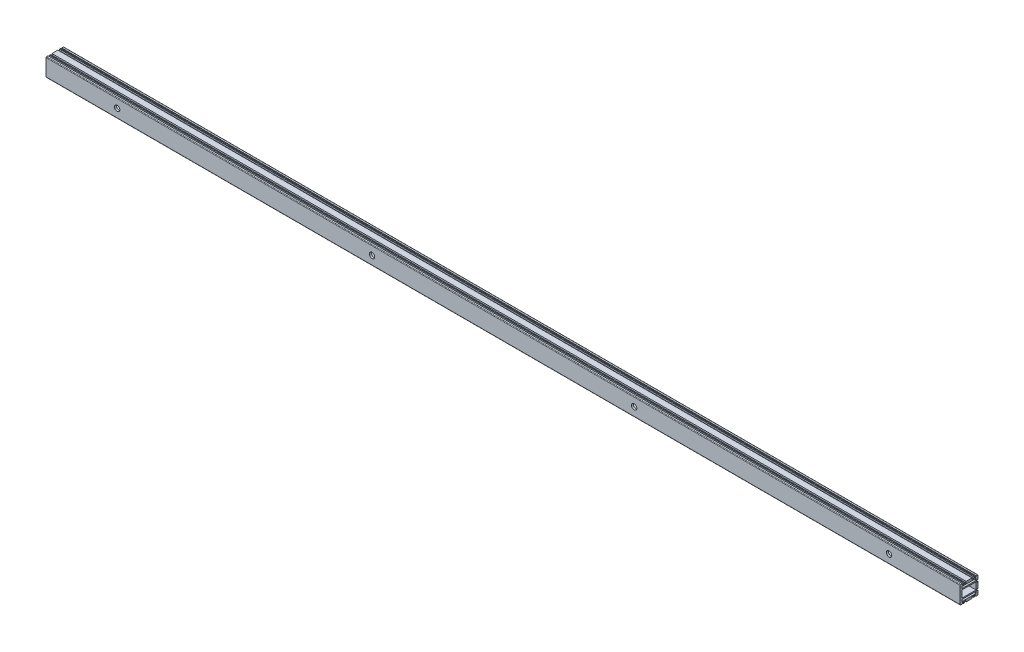
from build123d import *

# Parameters (mm, degrees)
SKETCH_1_W             = 23.5
SKETCH_1_H             = 12
EXTRUDE_1_DEPTH        = 771
HOLE_WIZARD_M6_1_D     = 5
HOLE_WIZARD_M6_1_DEPTH = 15
HOLE_WIZARD_M6_1_TIP   = 1.502151548
HOLE_WIZARD_M6_2_D     = 5
HOLE_WIZARD_M6_2_DEPTH = 15
HOLE_WIZARD_M6_2_TIP   = 1.502151548
SKETCH_6_R             = 4.5
CUT_EXTRUDE_1_DEPTH    = 772.729227126
HOLE_WIZARD_M4_1_D     = 3.3
HOLE_WIZARD_M4_1_DEPTH = 10.1
HOLE_WIZARD_M4_1_TIP   = 0.991420021
HOLE_WIZARD_M6_3_D     = 5
HOLE_WIZARD_M6_3_DEPTH = 15
HOLE_WIZARD_M6_3_TIP   = 1.502151548


with BuildPart() as part:
    # 草图1 → 凸台-拉伸1 (new, symmetric)
    with BuildSketch(Plane(origin=(0, 0, 0), x_dir=(0, 0, -1), z_dir=(1, 0, 0))):
        with BuildLine():
            Line((-14, 15), (-11.5, 15))
            Line((-11.5, 15), (-11.5, 13.5))
            Line((-11.5, 13.5), (-11.4, 13.5))
            ThreePointArc((-11.4, 13.5), (-11.117157288, 13.382842712), (-11, 13.1))
            Line((-11, 13.1), (-11, 12))
            Line((-11, 12), (-9.5, 12))
            Line((-9.5, 12), (-9.5, 15))
            Line((-9.5, 15), (-8, 15))
            Line((-8, 15), (-8, 12.5))
            Line((-8, 12.5), (-5, 12.5))
            Line((-5, 12.5), (-5, 15))
            Line((-5, 15), (5, 15))
            Line((5, 15), (5, 12.5))
            Line((5, 12.5), (8, 12.5))
            Line((8, 12.5), (8, 15))
            Line((8, 15), (9.5, 15))
            Line((9.5, 15), (9.5, 12))
            Line((9.5, 12), (11, 12))
            Line((11, 12), (11, 13.1))
            ThreePointArc((11, 13.1), (11.117157288, 13.382842712), (11.4, 13.5))
            Line((11.4, 13.5), (11.5, 13.5))
            Line((11.5, 13.5), (11.5, 15))
            Line((11.5, 15), (14, 15))
            ThreePointArc((14, 15), (14.707106781, 14.707106781), (15, 14))
            Line((15, 14), (15, 8))
            Line((15, 8), (12.5, 8))
            Line((12.5, 8), (12.5, 5))
            Line((12.5, 5), (15, 5))
            Line((15, 5), (15, -5))
            Line((15, -5), (12.5, -5))
            Line((12.5, -5), (12.5, -8))
            Line((12.5, -8), (15, -8))
            Line((15, -8), (15, -14))
            ThreePointArc((15, -14), (14.707106781, -14.707106781), (14, -15))
            Line((14, -15), (11.5, -15))
            Line((11.5, -15), (11.5, -13.5))
            Line((11.5, -13.5), (11.4, -13.5))
            ThreePointArc((11.4, -13.5), (11.117157288, -13.382842712), (11, -13.1))
            Line((11, -13.1), (11, -12))
            Line((11, -12), (9.5, -12))
            Line((9.5, -12), (9.5, -15))
            Line((9.5, -15), (8, -15))
            Line((8, -15), (8, -12.5))
            Line((8, -12.5), (5, -12.5))
            Line((5, -12.5), (5, -15))
            Line((5, -15), (-5, -15))
            Line((-5, -15), (-5, -12.5))
            Line((-5, -12.5), (-8, -12.5))
            Line((-8, -12.5), (-8, -15))
            Line((-8, -15), (-9.5, -15))
            Line((-9.5, -15), (-9.5, -12))
            Line((-9.5, -12), (-11, -12))
            Line((-11, -12), (-11, -13.1))
            ThreePointArc((-11, -13.1), (-11.117157288, -13.382842712), (-11.4, -13.5))
            Line((-11.4, -13.5), (-11.5, -13.5))
            Line((-11.5, -13.5), (-11.5, -15))
            Line((-11.5, -15), (-14, -15))
            ThreePointArc((-14, -15), (-14.707106781, -14.707106781), (-15, -14))
            Line((-15, -14), (-15, 14))
            ThreePointArc((-15, 14), (-14.707106781, 14.707106781), (-14, 15))
        make_face()
        with BuildLine():
            Line((12, -10.5), (12, -8.5))
            ThreePointArc((12, -8.5), (11.853553391, -8.146446609), (11.5, -8))
            Line((11.5, -8), (-11.5, -8))
            ThreePointArc((-11.5, -8), (-11.853553391, -8.146446609), (-12, -8.5))
            Line((-12, -8.5), (-12, -10.5))
            ThreePointArc((-12, -10.5), (-11.853553391, -10.853553391), (-11.5, -11))
            Line((-11.5, -11), (11.5, -11))
            ThreePointArc((11.5, -11), (11.853553391, -10.853553391), (12, -10.5))
        make_face(mode=Mode.SUBTRACT)
        with BuildLine():
            Line((-11.5, 11), (11.5, 11))
            ThreePointArc((11.5, 11), (11.853553391, 10.853553391), (12, 10.5))
            Line((12, 10.5), (12, 8.5))
            ThreePointArc((12, 8.5), (11.853553391, 8.146446609), (11.5, 8))
            Line((11.5, 8), (-11.5, 8))
            ThreePointArc((-11.5, 8), (-11.853553391, 8.146446609), (-12, 8.5))
            Line((-12, 8.5), (-12, 10.5))
            ThreePointArc((-12, 10.5), (-11.853553391, 10.853553391), (-11.5, 11))
        make_face(mode=Mode.SUBTRACT)
        Rectangle(SKETCH_1_W, SKETCH_1_H, mode=Mode.SUBTRACT)
    extrude(amount=EXTRUDE_1_DEPTH, both=True)

    # M6 螺纹孔1
    with Locations(Plane.XZ.offset(15)):
        with Locations((-751, 0), (-736, 0), (-566, 0), (-551, 0), (-481, 0), (-466, 0), (94, 0), (109, 0), (179, 0), (194, 0), (736, 0), (751, 0)):
            Hole(HOLE_WIZARD_M6_1_D / 2, depth=HOLE_WIZARD_M6_1_DEPTH)
            with Locations((0, 0, -(HOLE_WIZARD_M6_1_DEPTH + HOLE_WIZARD_M6_1_TIP / 2))):  # 118° drill point
                Cone(0, HOLE_WIZARD_M6_1_D / 2, HOLE_WIZARD_M6_1_TIP, mode=Mode.SUBTRACT)

    # M6 螺纹孔2
    with Locations(Plane(origin=(0, 0, -15), x_dir=(-1, 0, 0), z_dir=(0, 0, -1))):
        with Locations((751, 0), (736, 0), (566, 0), (551, 0), (481, 0), (466, 0), (-481, 0), (-466, 0), (-551, 0), (-566, 0), (-751, 0), (-736, 0)):
            Hole(HOLE_WIZARD_M6_2_D / 2, depth=HOLE_WIZARD_M6_2_DEPTH)
            with Locations((0, 0, -(HOLE_WIZARD_M6_2_DEPTH + HOLE_WIZARD_M6_2_TIP / 2))):  # 118° drill point
                Cone(0, HOLE_WIZARD_M6_2_D / 2, HOLE_WIZARD_M6_2_TIP, mode=Mode.SUBTRACT)

    # 草图6 → 切除-拉伸1 (cut, through all)
    with BuildSketch(Plane(origin=(0, 0, -15), x_dir=(-1, 0, 0), z_dir=(0, 0, -1))):
        with Locations((-651, 0)):
            Circle(SKETCH_6_R)
        with Locations((-221, 0)):
            Circle(SKETCH_6_R)
        with Locations((221, 0)):
            Circle(SKETCH_6_R)
        with Locations((651, 0)):
            Circle(SKETCH_6_R)
    extrude(amount=-CUT_EXTRUDE_1_DEPTH, mode=Mode.SUBTRACT)

    # M4 螺纹孔1
    with Locations(Plane.XZ.offset(15)):
        with Locations((711, 0), (591, 0), (471, 0), (221, 0)):
            Hole(HOLE_WIZARD_M4_1_D / 2, depth=HOLE_WIZARD_M4_1_DEPTH)
            with Locations((0, 0, -(HOLE_WIZARD_M4_1_DEPTH + HOLE_WIZARD_M4_1_TIP / 2))):  # 118° drill point
                Cone(0, HOLE_WIZARD_M4_1_D / 2, HOLE_WIZARD_M4_1_TIP, mode=Mode.SUBTRACT)

    # M6 螺纹孔3
    with Locations(Plane.XZ.offset(15)):
        with Locations((-221, 0)):
            Hole(HOLE_WIZARD_M6_3_D / 2, depth=HOLE_WIZARD_M6_3_DEPTH)
            with Locations((0, 0, -(HOLE_WIZARD_M6_3_DEPTH + HOLE_WIZARD_M6_3_TIP / 2))):  # 118° drill point
                Cone(0, HOLE_WIZARD_M6_3_D / 2, HOLE_WIZARD_M6_3_TIP, mode=Mode.SUBTRACT)


solid = part.part
